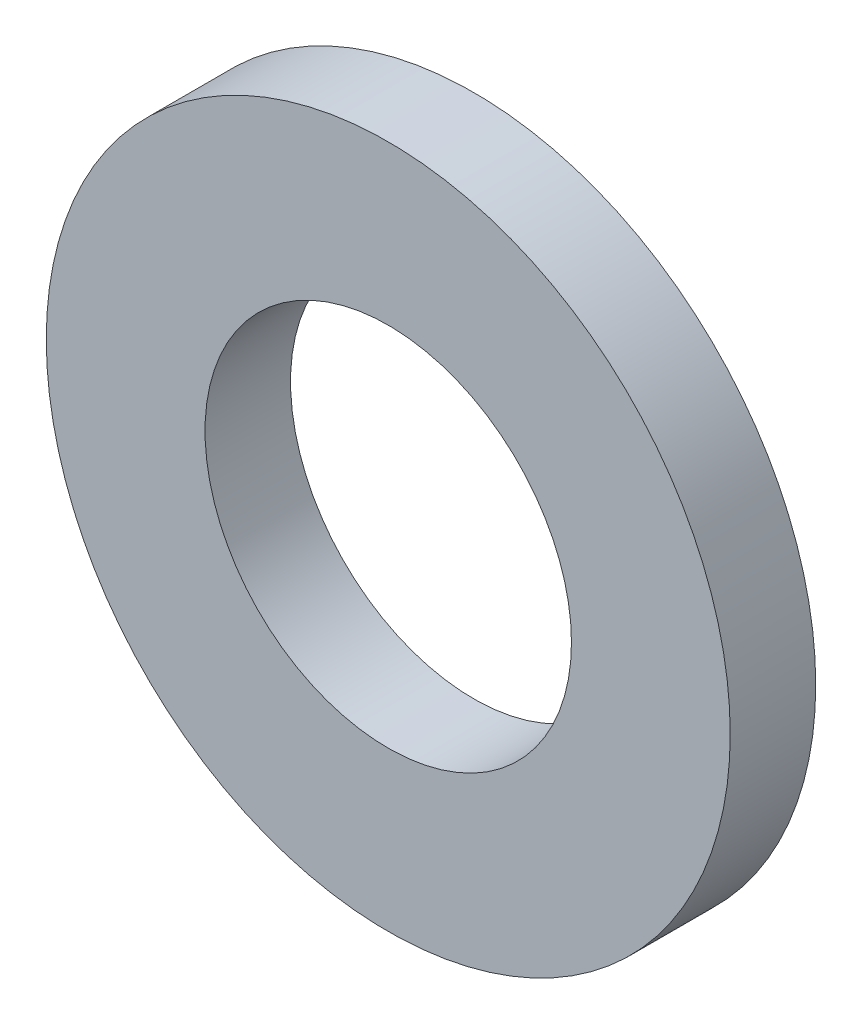
from build123d import *

# Parameters (mm, degrees)
SKIZZE1_R                       = 14
SKIZZE1_R_2                     = 7.5
AUFSATZ_LINEAR_AUSTRAGEN1_DEPTH = 3.5


with BuildPart() as part:
    # Skizze1 → Aufsatz-Linear austragen1 (new body)
    with BuildSketch(Plane.XY):
        Circle(SKIZZE1_R)
        Circle(SKIZZE1_R_2, mode=Mode.SUBTRACT)
    extrude(amount=AUFSATZ_LINEAR_AUSTRAGEN1_DEPTH)


solid = part.part
